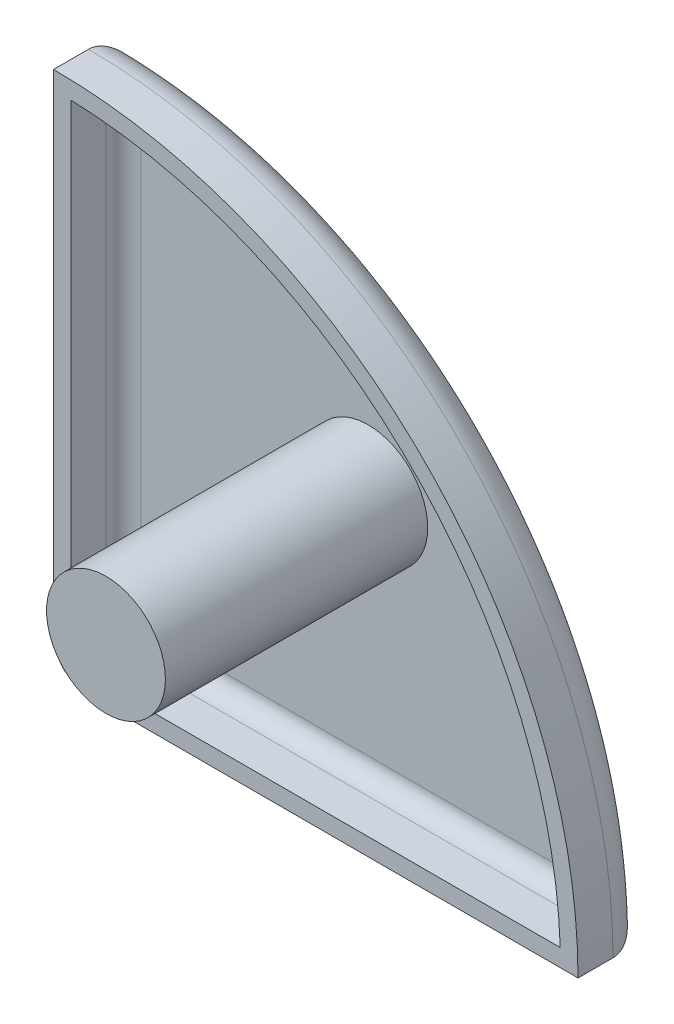
from build123d import *

# Parameters (mm, degrees)
SKETCH_1_W          = 30
SKETCH_1_H          = 30
EXTRUDE_1_DEPTH     = 4
CUT_EXTRUDE_1_DEPTH = 22.587033145
FILLET_1_R          = 2
SHELL_1_T           = -1
SKETCH_2_R          = 3.4
EXTRUDE_2_DEPTH     = 15


with BuildPart() as part:
    # 草图1 → 凸台-拉伸1 (new body)
    with BuildSketch(Plane.XY):
        Rectangle(SKETCH_1_W, SKETCH_1_H)
    extrude(amount=EXTRUDE_1_DEPTH)

    # 草图4 → 切除-拉伸1 (cut, through all)
    with BuildSketch(Plane.XY.offset(4)):
        with BuildLine():
            Line((-15, 15), (15, 15))
            Line((15, 15), (15, -15))
            ThreePointArc((15, -15), (6.213203436, 6.213203436), (-15, 15))
        make_face()
    extrude(amount=-CUT_EXTRUDE_1_DEPTH, mode=Mode.SUBTRACT)

    # 圆角1
    fillet_1_edges = [part.edges().sort_by_distance(p)[0] for p in [
        (6.213203436, 6.213203436, 0),
        (0, -15, 0),
        (-15, 0, 0),
        (-15, -15, 2),
    ]]
    fillet(fillet_1_edges, radius=FILLET_1_R)

    # 抽壳1
    shell_1_openings = [part.faces().sort_by_distance(p)[0] for p in [
        (-2.252666732, -2.252666732, 4),
    ]]
    offset(amount=SHELL_1_T, openings=shell_1_openings)

    # 草图2 → 凸台-拉伸2 (add)
    with BuildSketch(Plane.XY.offset(1)):
        Circle(SKETCH_2_R)
    extrude(amount=EXTRUDE_2_DEPTH)


solid = part.part
